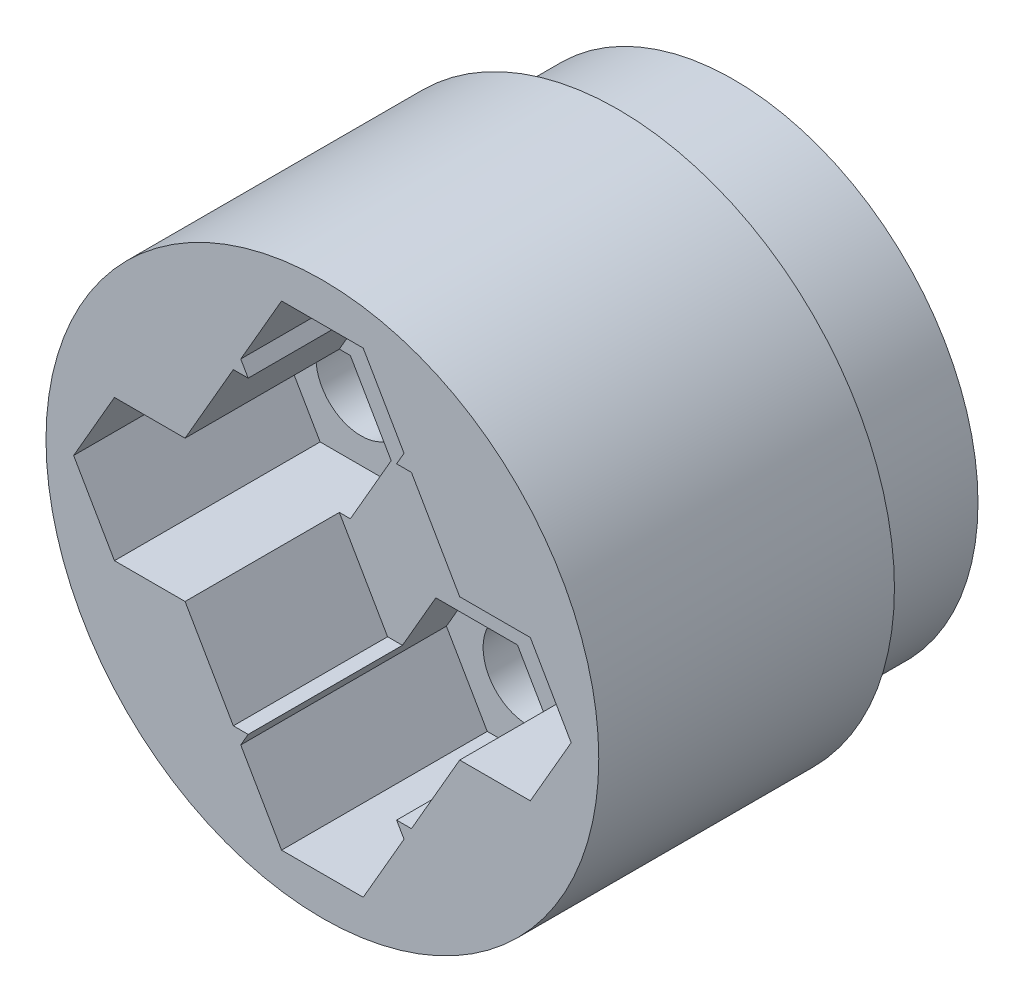
from build123d import *

# Parameters (mm, degrees)
SKETCH1_R           = 9.5
BOSS_EXTRUDE1_DEPTH = 16
SKETCH1_3_R         = 10.75
SKETCH1_3_R_2       = 9.5
BOSS_EXTRUDE2_DEPTH = 11.5
SKETCH2_R           = 2
CUT_EXTRUDE1_DEPTH  = 23.070908454
SKETCH3_R           = 1.75
CUT_EXTRUDE2_DEPTH  = 23.070908454
CUT_EXTRUDE7_START  = -8
SKETCH5_R           = 1.75
CUT_EXTRUDE7_DEPTH  = 8
CUT_EXTRUDE8_DEPTH  = 6


with BuildPart() as part:
    # Sketch1 → Boss-Extrude1 (new body)
    with BuildSketch(Plane.XY):
        Circle(SKETCH1_R)
    extrude(amount=-BOSS_EXTRUDE1_DEPTH)

    # Sketch1<3> → Boss-Extrude2 (add)
    with BuildSketch(Plane.XY):
        Circle(SKETCH1_3_R)
        Circle(SKETCH1_3_R_2, mode=Mode.SUBTRACT)
    extrude(amount=-BOSS_EXTRUDE2_DEPTH)

    # Sketch2 → Cut-Extrude1 (cut, through all)
    with BuildSketch(Plane.XY):
        Circle(SKETCH2_R)
    extrude(amount=-CUT_EXTRUDE1_DEPTH, mode=Mode.SUBTRACT)

    # Sketch3 → Cut-Extrude2 (cut, through all)
    with BuildSketch(Plane(origin=(0, 0, -16), x_dir=(-1, 0, 0), z_dir=(0, 0, -1))):
        with Locations((-6.5, 0)):
            Circle(SKETCH3_R)
        with Locations((0, 6.5)):
            Circle(SKETCH3_R)
        with Locations((6.5, 0)):
            Circle(SKETCH3_R)
        with Locations((0, -6.5)):
            Circle(SKETCH3_R)
    extrude(amount=-CUT_EXTRUDE2_DEPTH, mode=Mode.SUBTRACT)

    # Sketch5 → Cut-Extrude7 (cut)
    # profile 1 of 4: a face of its own
    with BuildSketch(Plane.XY.offset(CUT_EXTRUDE7_START)):
        Polygon((-1.58771324, 3.75), (1.58771324, 3.75), (3.175426481, 6.5), (1.58771324, 9.25), (-1.58771324, 9.25), (-3.175426481, 6.5), align=None)
        with Locations((0, 6.5)):
            Circle(SKETCH5_R, mode=Mode.SUBTRACT)
    # profile 2 of 4: a face of its own
    with BuildSketch(Plane.XY.offset(CUT_EXTRUDE7_START)):
        Polygon((-8.08771324, -2.75), (-4.91228676, -2.75), (-3.324573519, 0), (-4.91228676, 2.75), (-8.08771324, 2.75), (-9.675426481, 0), align=None)
    # profile 3 of 4: a face of its own
    with BuildSketch(Plane.XY.offset(CUT_EXTRUDE7_START)):
        Polygon((-1.58771324, -9.25), (1.58771324, -9.25), (3.175426481, -6.5), (1.58771324, -3.75), (-1.58771324, -3.75), (-3.175426481, -6.5), align=None)
        with Locations((0, -6.5)):
            Circle(SKETCH5_R, mode=Mode.SUBTRACT)
    # profile 4 of 4: a face of its own
    with BuildSketch(Plane.XY.offset(CUT_EXTRUDE7_START)):
        Polygon((4.91228676, -2.75), (8.08771324, -2.75), (9.675426481, 0), (8.08771324, 2.75), (4.91228676, 2.75), (3.324573519, 0), align=None)
        with Locations((6.5, 0)):
            Circle(SKETCH5_R, mode=Mode.SUBTRACT)
    extrude(amount=CUT_EXTRUDE7_DEPTH, mode=Mode.SUBTRACT)

    # Sketch6 → Cut-Extrude8 (cut)
    with BuildSketch(Plane.XY):
        Polygon((3.464101615, -6), (6.92820323, 0), (3.464101615, 6), (-3.464101615, 6), (-6.92820323, 0), (-3.464101615, -6), align=None)
    extrude(amount=-CUT_EXTRUDE8_DEPTH, mode=Mode.SUBTRACT)


solid = part.part
